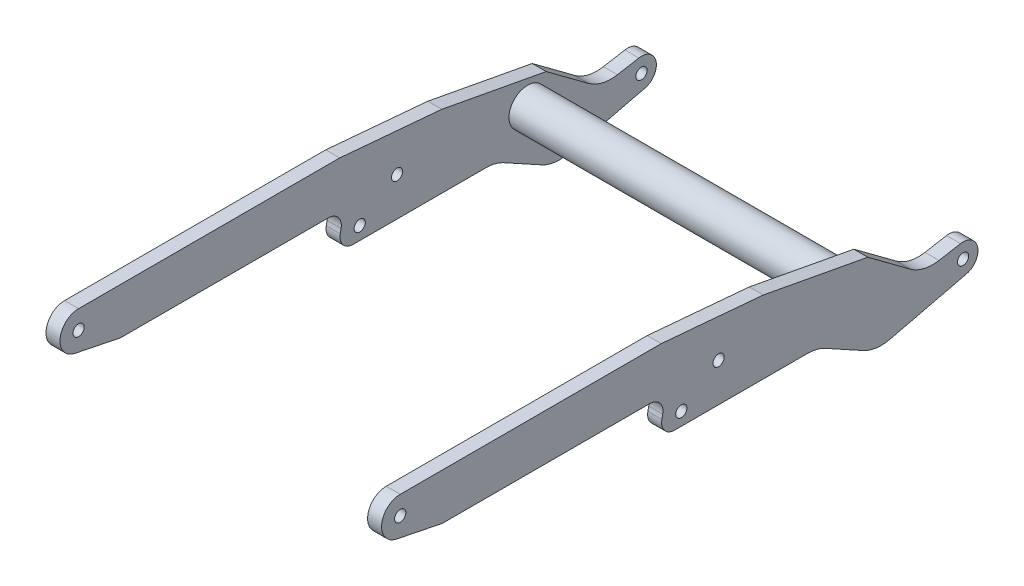
from build123d import *

# Parameters (mm, degrees)
SKETCH1_R               = 3.81
BOSS_EXTRUDE2_DEPTH     = 228.6
CUT_EXTRUDE1_DEPTH      = 319.859436188
CUT_EXTRUDE1_DEPTH_BACK = 319.859436188
SKETCH3_W               = 209.55
SKETCH3_H               = 457.691503211
SKETCH4_R               = 12.7
BOSS_EXTRUDE3_DEPTH     = 209.55
SCALE1_SCALE            = 2.33


with BuildPart() as part:
    # Sketch1 → Boss-Extrude2 (new body)
    with BuildSketch(Plane(origin=(0, 0, 0), x_dir=(0, 0, -1), z_dir=(1, 0, 0))):
        with BuildLine():
            Line((-203.426935692, 51.985841481), (-25.626935692, 51.985841481))
            Line((-25.626935692, 51.985841481), (43.95726397, 45.89801285))
            Line((43.95726397, 45.89801285), (115.111953895, 32.581774579))
            Line((115.111953895, 32.581774579), (144.05370572, 11.087732787))
            ThreePointArc((144.05370572, 11.087732787), (153.355215288, 6.760397028), (163.609819182, 6.46541568))
            Line((163.609819182, 6.46541568), (178.236347054, 9.045273838))
            ThreePointArc((178.236347054, 9.045273838), (189.948133915, 1.109278265), (182.373529856, -10.839418341))
            Line((182.373529856, -10.839418341), (130.185840083, -23.371799314))
            ThreePointArc((130.185840083, -23.371799314), (120.873250401, -23.847836103), (112.016417856, -20.931081935))
            Line((112.016417856, -20.931081935), (86.281753804, -6.780434321))
            ThreePointArc((86.281753804, -6.780434321), (80.361073143, -4.435827092), (74.043286945, -3.637566412))
            Line((74.043286945, -3.637566412), (-16.495949676, -3.637566412))
            ThreePointArc((-16.495949676, -3.637566412), (-23.382114066, -0.370096092), (-25.206335201, 7.030433588))
            Line((-25.206335201, 7.030433588), (-24.63601234, 9.824433588))
            ThreePointArc((-24.63601234, 9.824433588), (-26.460233475, 17.224963268), (-33.346397865, 20.492433588))
            Line((-33.346397865, 20.492433588), (-174.858415958, 20.492433588))
            Line((-174.858415958, 20.492433588), (-205.966935692, 26.842433588))
            ThreePointArc((-205.966935692, 26.842433588), (-216.062624835, 40.562305299), (-203.426935692, 51.985841481))
        make_face()
        with Locations((-203.426935692, 39.285841481)):
            Circle(SKETCH1_R, mode=Mode.SUBTRACT)
        with Locations((-11.93601234, 5.252433588)):
            Circle(SKETCH1_R, mode=Mode.SUBTRACT)
        with Locations((13.46398766, 22.651433588)):
            Circle(SKETCH1_R, mode=Mode.SUBTRACT)
        with Locations((180.001147709, -0.960278553)):
            Circle(SKETCH1_R, mode=Mode.SUBTRACT)
    extrude(amount=-BOSS_EXTRUDE2_DEPTH)

    # Sketch3 → Cut-Extrude1 (cut, two sides: drawn at the far end of the back side and taken through both)
    with BuildSketch(Plane(origin=(0, 0, 0), x_dir=(1, 0, 0), z_dir=(0, 1, 0)).offset(-CUT_EXTRUDE1_DEPTH_BACK)):
        with Locations((-114.3, -18.881102173)):
            Rectangle(SKETCH3_W, SKETCH3_H)
    extrude(amount=CUT_EXTRUDE1_DEPTH + CUT_EXTRUDE1_DEPTH_BACK, mode=Mode.SUBTRACT)


with BuildPart() as cut_extrude1_piece_1:
    # of the separate pieces the step leaves, piece 1, a body of its own (cut_extrude1_pieces)
    add(part.part.solids().sort_by_distance((0, 51.985841481, 203.426935692))[0])



with BuildPart() as cut_extrude1_piece_2:
    # of the separate pieces the step leaves, piece 2, a body of its own (cut_extrude1_pieces)
    add(part.part.solids().sort_by_distance((-219.075, 51.985841481, 203.426935692))[0])


with BuildPart() as cut_extrude1_piece_1_1:
    add(cut_extrude1_piece_1.part)

    add(cut_extrude1_piece_2.part)  # Boss-Extrude3 merges Cut-Extrude1 piece 2
    # Sketch4 → Boss-Extrude3 (add)
    with BuildSketch(Plane(origin=(-219.075, 0, 0), x_dir=(0, 0, -1), z_dir=(1, 0, 0))):
        with Locations(Location((102.411953895, 18.161886375, 0), (0, 0, 180))):
            Circle(SKETCH4_R)
    extrude(amount=BOSS_EXTRUDE3_DEPTH)


with BuildPart() as cut_extrude1_piece_1_2:
    # Scale1: scaled about (-114.3, 21.499691493, -25.72204861)
    add(cut_extrude1_piece_1_1.part.scale(SCALE1_SCALE).moved(Location((152.019, -28.594589686, 34.210324651))))


solid = cut_extrude1_piece_1_2.part
